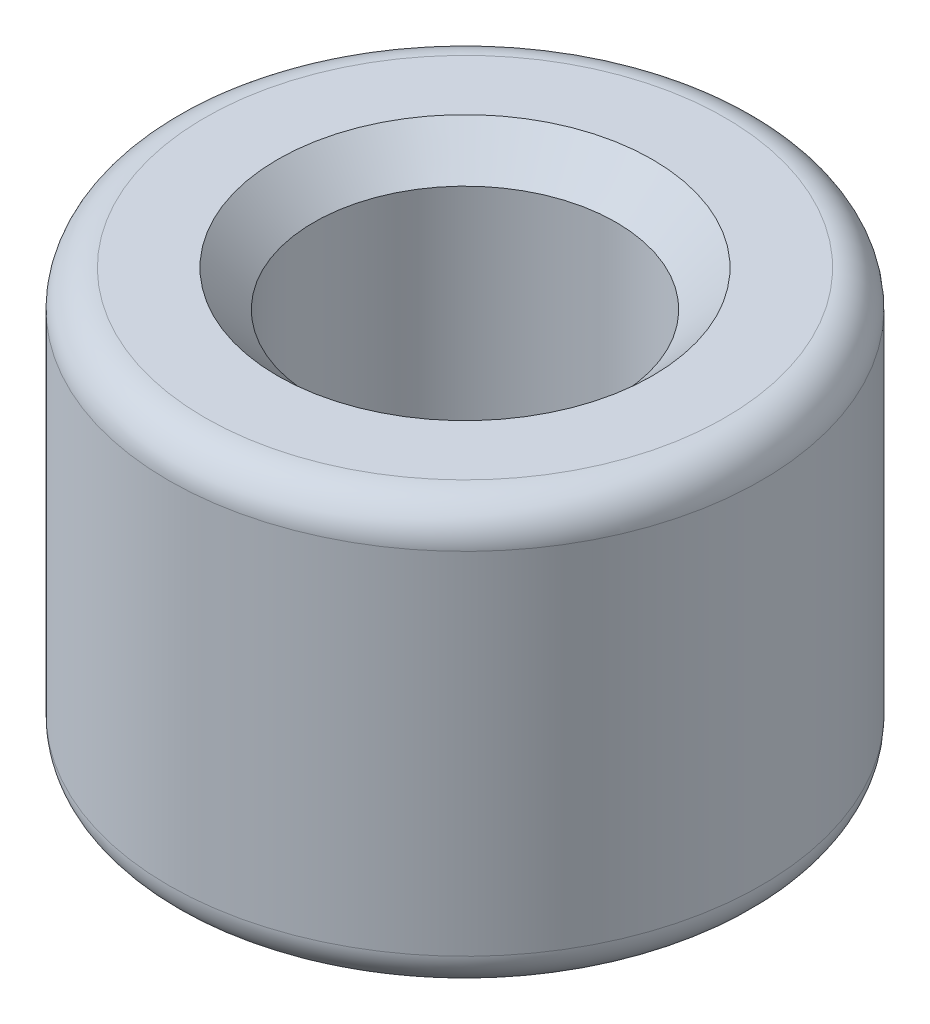
from build123d import *

# Parameters (mm, degrees)
SKETCH1_R           = 2.45
SKETCH1_R_2         = 1.25
BOSS_EXTRUDE1_DEPTH = 1.75
CHAMFER1_SIZE       = 0.3
FILLET1_R           = 0.3


with BuildPart() as part:
    # Sketch1 → Boss-Extrude1 (new, symmetric)
    with BuildSketch(Plane(origin=(0, 0, 0), x_dir=(1, 0, 0), z_dir=(0, 1, 0))):
        with Locations(Location((0, 0, 0), (0, 0, 270))):
            Circle(SKETCH1_R)
        with Locations(Location((0, 0, 0), (0, 0, 270))):
            Circle(SKETCH1_R_2, mode=Mode.SUBTRACT)
    extrude(amount=BOSS_EXTRUDE1_DEPTH, both=True)

    # Chamfer1
    chamfer1_edges = [part.edges().sort_by_distance(p)[0] for p in [
        (0, -1.75, -1.25),
        (0, 1.75, -1.25),
    ]]
    chamfer(chamfer1_edges, length=CHAMFER1_SIZE)

    # Fillet1
    fillet1_edges = [part.edges().sort_by_distance(p)[0] for p in [
        (0, -1.75, -2.45),
        (0, 1.75, -2.45),
    ]]
    fillet(fillet1_edges, radius=FILLET1_R)


solid = part.part
